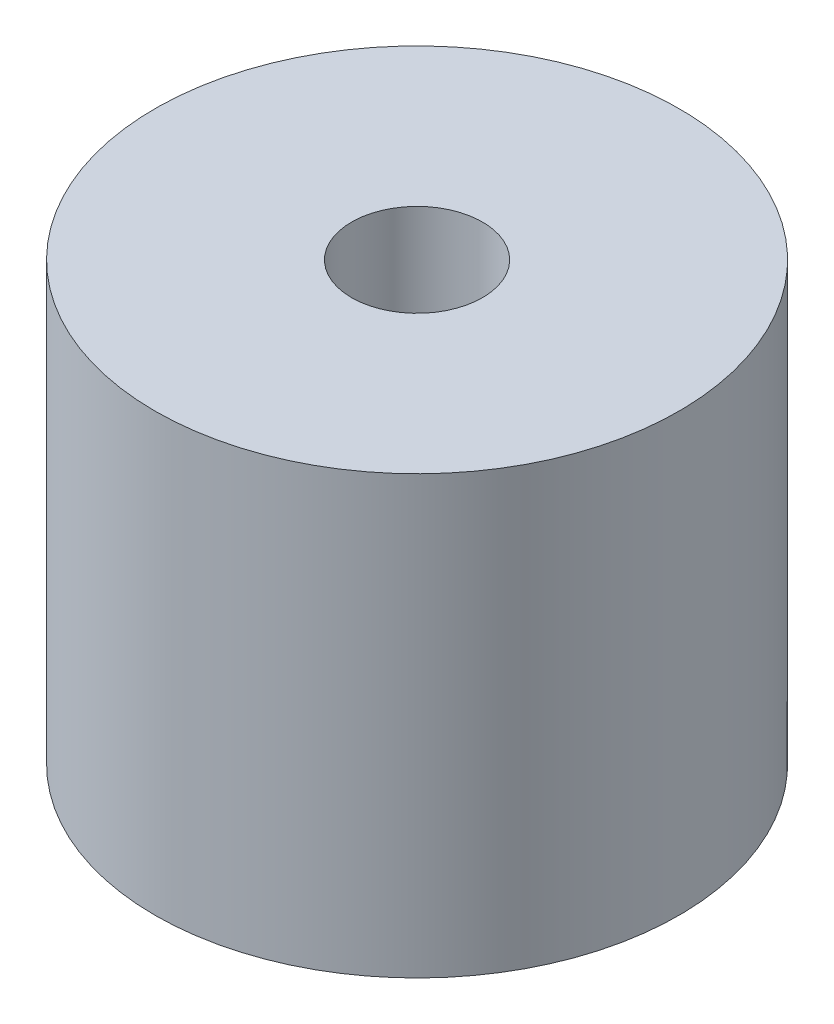
from build123d import *

# Parameters (mm, degrees)
SKETCH1_R           = 3
BOSS_EXTRUDE1_DEPTH = 5
SKETCH2_R           = 0.75
CUT_EXTRUDE1_DEPTH  = 7.557438524


with BuildPart() as part:
    # Sketch1 → Boss-Extrude1 (new body)
    with BuildSketch(Plane(origin=(0, 0, 0), x_dir=(1, 0, 0), z_dir=(0, 1, 0))):
        with Locations(Location((0, 0, 0), (0, 0, 270))):
            Circle(SKETCH1_R)
    extrude(amount=BOSS_EXTRUDE1_DEPTH)

    # Sketch2 → Cut-Extrude1 (cut, through all)
    with BuildSketch(Plane(origin=(0, 5, 0), x_dir=(1, 0, 0), z_dir=(0, 1, 0))):
        with Locations(Location((0, 0, 0), (0, 0, 270))):
            Circle(SKETCH2_R)
    extrude(amount=-CUT_EXTRUDE1_DEPTH, mode=Mode.SUBTRACT)


solid = part.part
